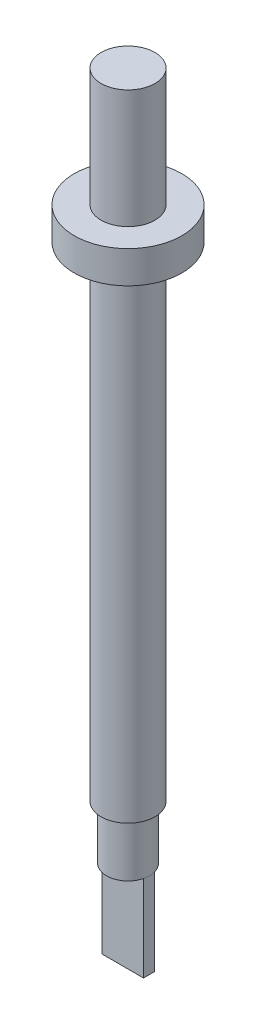
from build123d import *

# Parameters (mm, degrees)
SKETCH4_W           = 3.872983346
SKETCH4_H           = 1
BOSS_EXTRUDE1_DEPTH = 8
SKETCH5_R           = 2.5
BOSS_EXTRUDE2_DEPTH = 11


with BuildPart() as part:
    # Sketch2 → Revolve1 (revolve)
    with BuildSketch(Plane.XY, mode=Mode.PRIVATE) as revolve1_sk:
        Polygon((0, 0), (0, 50), (0, 53), (5, 53), (5, 50), (2.5, 50), (2.5, 5), (2, 5), (2, 0), align=None)
    revolve(revolve1_sk.sketch.rotate(Axis((0, 0, 0), (0, 1, 0)), 90), axis=Axis((0, 0, 0), (0, 1, 0)))

    # Sketch4 → Boss-Extrude1 (add)
    with BuildSketch(Plane.XZ):
        Rectangle(SKETCH4_W, SKETCH4_H)
    extrude(amount=BOSS_EXTRUDE1_DEPTH)

    # Sketch5 → Boss-Extrude2 (add)
    with BuildSketch(Plane(origin=(0, 53, 0), x_dir=(1, 0, 0), z_dir=(0, 1, 0))):
        with Locations(Location((0, 0, 0), (0, 0, 90))):
            Circle(SKETCH5_R)
    extrude(amount=BOSS_EXTRUDE2_DEPTH)


solid = part.part
